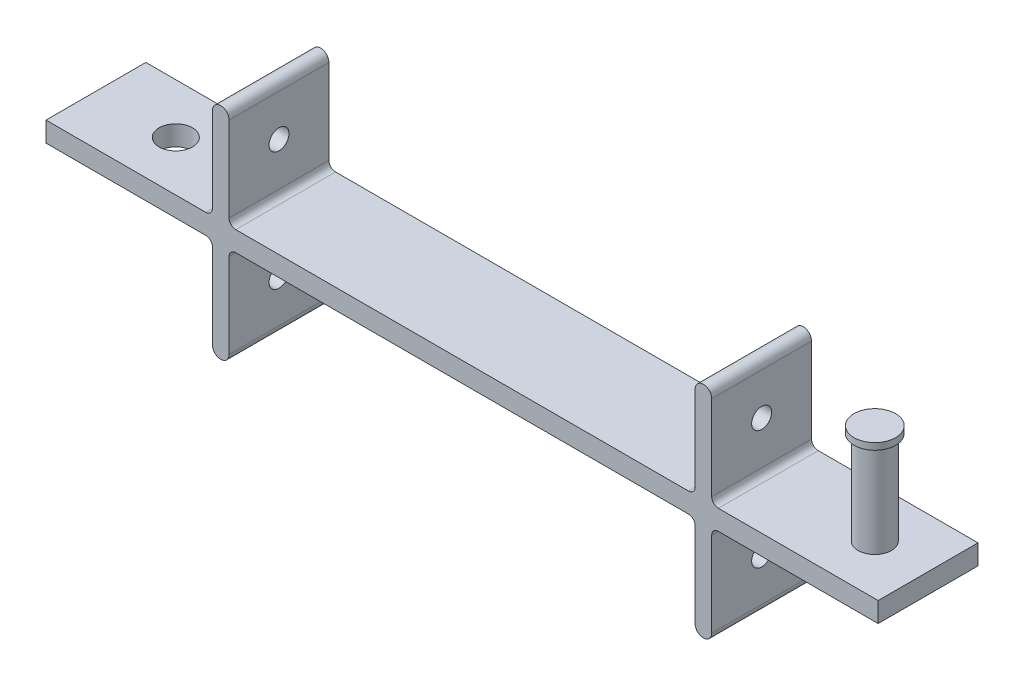
from build123d import *

# Parameters (mm, degrees)
BOSS_EXTRUDE1_DEPTH  = 30
FILLET1_R            = 2
FILLET2_RADIUS       = 2.5
FILLET2_LENGTH       = 30
FILLET3_RADIUS       = 2.5
FILLET3_LENGTH       = 30
FILLET4_R            = 2
SKETCH2_R            = 3
CUT_EXTRUDE4_DEPTH   = 163
SKETCH9_W            = 10
SKETCH9_H            = 6
BOSS_EXTRUDE8_DEPTH  = 30
SKETCH14_W           = 20
SKETCH14_H           = 6
BOSS_EXTRUDE12_DEPTH = 30
FILLET10_RADIUS      = 2.5
FILLET10_LENGTH      = 30
FILLET11_RADIUS      = 2.5
FILLET11_LENGTH      = 30
FILLET12_R           = 2
SKETCH16_R           = 3
CUT_EXTRUDE6_DEPTH   = 200
SKETCH17_W           = 30
SKETCH17_H           = 6
BOSS_EXTRUDE15_DEPTH = 30
SKETCH20_R           = 5
BOSS_EXTRUDE16_DEPTH = 36
SKETCH21_R           = 6.25
BOSS_EXTRUDE17_DEPTH = 2
SKETCH22_R           = 5
CUT_EXTRUDE7_DEPTH   = 10


with BuildPart() as part:
    # Sketch1 → Boss-Extrude1 (new body)
    with BuildSketch(Plane.XY):
        Polygon((-28.863636364, 0), (-48.863636364, 0), (-48.863636364, -30), (-53.863636364, -30), (-53.863636364, 0), (-193.863636364, 0), (-193.863636364, -30), (-198.863636364, -30), (-198.863636364, 0), (-218.863636364, 0), (-218.863636364, 6), (-198.863636364, 6), (-198.863636364, 36), (-193.863636364, 36), (-193.863636364, 6), (-53.863636364, 6), (-53.863636364, 36), (-48.863636364, 36), (-48.863636364, 6), (-28.863636364, 6), align=None)
    extrude(amount=BOSS_EXTRUDE1_DEPTH)

    # Fillet1
    fillet1_edges = [part.edges().sort_by_distance(p)[0] for p in [
        (-198.863636364, 6, 15),
        (-193.863636364, 6, 15),
    ]]
    fillet(fillet1_edges, radius=FILLET1_R)

    # Fillet2: full round fillet: the end face becomes a half cylinder, R = half its width
    fillet2_face = Plane((-196.363636364, 36, 15), x_dir=(0, 0, 1), z_dir=(0, 1, 0))  # on the end face: x along it, z out of the body
    fillet2_slab = fillet2_face.offset(-FILLET2_RADIUS / 2) * Box(FILLET2_LENGTH, 2 * FILLET2_RADIUS, FILLET2_RADIUS, mode=Mode.PRIVATE)  # the body's end, R deep
    fillet2_round = Plane((-196.363636364, 33.5, 15), x_dir=(0, 1, 0), z_dir=(0, 0, 1)) * Cylinder(FILLET2_RADIUS, FILLET2_LENGTH, mode=Mode.PRIVATE)  # its axis R under the face
    add(fillet2_slab - fillet2_round, mode=Mode.SUBTRACT)

    # Fillet3: full round fillet: the end face becomes a half cylinder, R = half its width
    fillet3_face = Plane((-51.363636364, 36, 15), x_dir=(0, 0, 1), z_dir=(0, 1, 0))  # on the end face: x along it, z out of the body
    fillet3_slab = fillet3_face.offset(-FILLET3_RADIUS / 2) * Box(FILLET3_LENGTH, 2 * FILLET3_RADIUS, FILLET3_RADIUS, mode=Mode.PRIVATE)  # the body's end, R deep
    fillet3_round = Plane((-51.363636364, 33.5, 15), x_dir=(0, 1, 0), z_dir=(0, 0, 1)) * Cylinder(FILLET3_RADIUS, FILLET3_LENGTH, mode=Mode.PRIVATE)  # its axis R under the face
    add(fillet3_slab - fillet3_round, mode=Mode.SUBTRACT)

    # Fillet4
    fillet4_edges = [part.edges().sort_by_distance(p)[0] for p in [
        (-53.863636364, 6, 15),
        (-48.863636364, 6, 15),
    ]]
    fillet(fillet4_edges, radius=FILLET4_R)

    # Sketch2 → Cut-Extrude4 (cut)
    with BuildSketch(Plane.ZY.offset(198.863636364)):
        with Locations((15, 21)):
            Circle(SKETCH2_R)
    extrude(amount=-CUT_EXTRUDE4_DEPTH, mode=Mode.SUBTRACT)

    # Sketch9 → Boss-Extrude8 (add)
    with BuildSketch(Plane(origin=(0, 0, 0), x_dir=(-1, 0, 0), z_dir=(0, 0, -1))):
        with Locations((223.863636364, 3)):
            Rectangle(SKETCH9_W, SKETCH9_H)
    extrude(amount=-BOSS_EXTRUDE8_DEPTH)

    # Sketch14 → Boss-Extrude12 (add)
    with BuildSketch(Plane(origin=(0, 0, 0), x_dir=(-1, 0, 0), z_dir=(0, 0, -1))):
        with Locations((238.863636364, 3)):
            Rectangle(SKETCH14_W, SKETCH14_H)
    extrude(amount=-BOSS_EXTRUDE12_DEPTH)

    # Fillet10: full round fillet: the end face becomes a half cylinder, R = half its width
    fillet10_face = Plane((-51.363636364, -30, 15), x_dir=(0, 0, 1), z_dir=(0, -1, 0))  # on the end face: x along it, z out of the body
    fillet10_slab = fillet10_face.offset(-FILLET10_RADIUS / 2) * Box(FILLET10_LENGTH, 2 * FILLET10_RADIUS, FILLET10_RADIUS, mode=Mode.PRIVATE)  # the body's end, R deep
    fillet10_round = Plane((-51.363636364, -27.5, 15), x_dir=(0, -1, 0), z_dir=(0, 0, 1)) * Cylinder(FILLET10_RADIUS, FILLET10_LENGTH, mode=Mode.PRIVATE)  # its axis R under the face
    add(fillet10_slab - fillet10_round, mode=Mode.SUBTRACT)

    # Fillet11: full round fillet: the end face becomes a half cylinder, R = half its width
    fillet11_face = Plane((-196.363636364, -30, 15), x_dir=(0, 0, 1), z_dir=(0, -1, 0))  # on the end face: x along it, z out of the body
    fillet11_slab = fillet11_face.offset(-FILLET11_RADIUS / 2) * Box(FILLET11_LENGTH, 2 * FILLET11_RADIUS, FILLET11_RADIUS, mode=Mode.PRIVATE)  # the body's end, R deep
    fillet11_round = Plane((-196.363636364, -27.5, 15), x_dir=(0, -1, 0), z_dir=(0, 0, 1)) * Cylinder(FILLET11_RADIUS, FILLET11_LENGTH, mode=Mode.PRIVATE)  # its axis R under the face
    add(fillet11_slab - fillet11_round, mode=Mode.SUBTRACT)

    # Fillet12
    fillet12_edges = [part.edges().sort_by_distance(p)[0] for p in [
        (-48.863636364, 0, 15),
        (-53.863636364, 0, 15),
        (-193.863636364, 0, 15),
        (-198.863636364, 0, 15),
    ]]
    fillet(fillet12_edges, radius=FILLET12_R)

    # Sketch16 → Cut-Extrude6 (cut)
    with BuildSketch(Plane(origin=(-48.863636364, 0, 0), x_dir=(0, 0, -1), z_dir=(1, 0, 0))):
        with Locations(Location((-15, -14.75, 0), (0, 0, 90))):
            Circle(SKETCH16_R)
    extrude(amount=-CUT_EXTRUDE6_DEPTH, mode=Mode.SUBTRACT)

    # Sketch17 → Boss-Extrude15 (add)
    with BuildSketch(Plane(origin=(0, 0, 0), x_dir=(-1, 0, 0), z_dir=(0, 0, -1))):
        with Locations((13.863636364, 3)):
            Rectangle(SKETCH17_W, SKETCH17_H)
    extrude(amount=-BOSS_EXTRUDE15_DEPTH)

    # Sketch20 → Boss-Extrude16 (add)
    with BuildSketch(Plane(origin=(0, 0, 0), x_dir=(-1, 0, 0), z_dir=(0, -1, 0))):
        with Locations(Location((14.863636364, -15, 0), (0, 0, 90))):
            Circle(SKETCH20_R)
    extrude(amount=-BOSS_EXTRUDE16_DEPTH)

    # Sketch21 → Boss-Extrude17 (add)
    with BuildSketch(Plane(origin=(0, 36, 0), x_dir=(-1, 0, 0), z_dir=(0, 1, 0))):
        with Locations(Location((14.863636364, 15, 0), (0, 0, 90))):
            Circle(SKETCH21_R)
    extrude(amount=-BOSS_EXTRUDE17_DEPTH)

    # Sketch22 → Cut-Extrude7 (cut)
    with BuildSketch(Plane(origin=(0, 6, 0), x_dir=(1, 0, 0), z_dir=(0, 1, 0))):
        with Locations(Location((-224.863636364, -15, 0), (0, 0, 180))):
            Circle(SKETCH22_R)
    extrude(amount=-CUT_EXTRUDE7_DEPTH, mode=Mode.SUBTRACT)


solid = part.part
